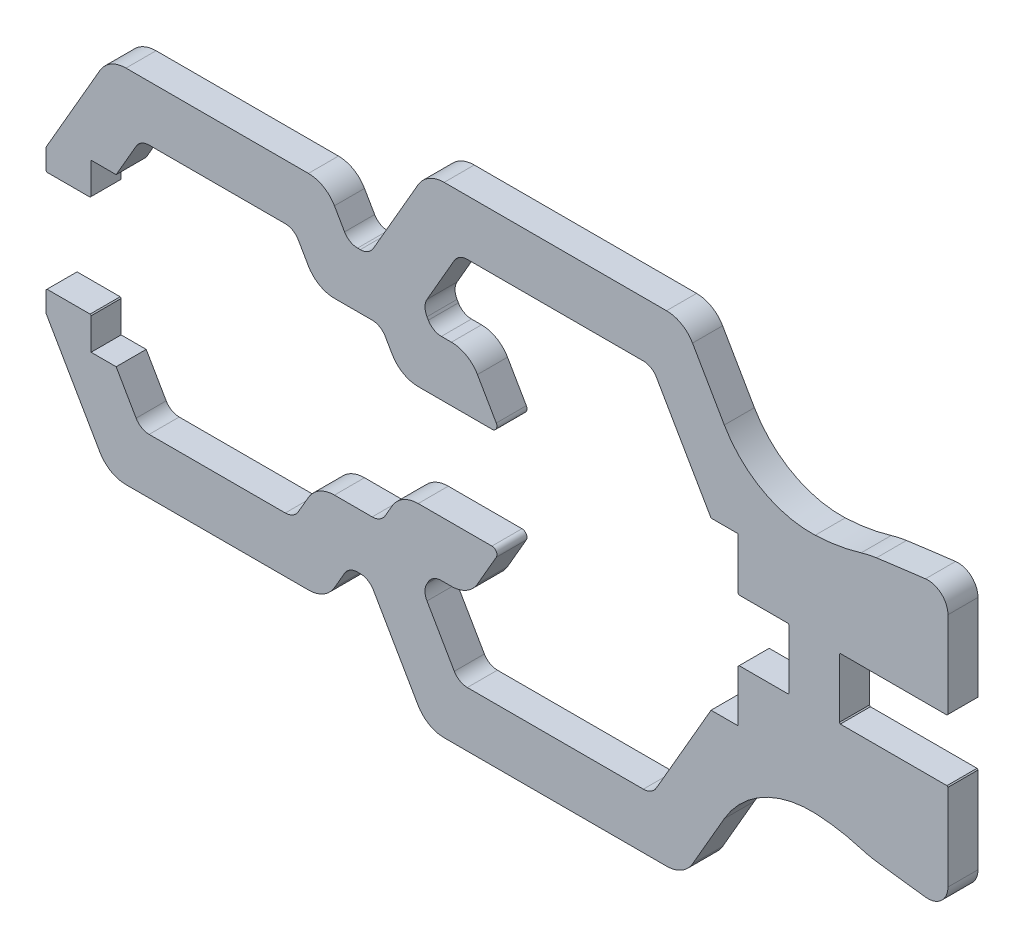
from build123d import *

# Parameters (mm, degrees)
EXTRUDE_1_DEPTH = 1.5
FILLET_4_R      = 10
FILLET_7_R      = 1.5
FILLET_8_R      = 3
CHAMFER_1_SIZE  = 0.1
FILLET_9_R      = 2
FILLET_10_R     = 0.5


with BuildPart() as part:
    # 草图1 → 凸台-拉伸1 (new, symmetric)
    with BuildSketch(Plane.XY):
        with BuildLine():
            Line((-130, 3.05), (-130, 14.015709241))
            ThreePointArc((-130, 14.015709241), (-134.003306479, 13.533897343), (-138, 13))
            ThreePointArc((-138, 13), (-144, 12), (-150, 13))
            Line((-150, 13), (-156.350852961, 24))
            Line((-156.350852961, 24), (-182, 24))
            Line((-182, 24), (-187.773502692, 14))
            Line((-187.773502692, 14), (-189.773502692, 14))
            Line((-189.773502692, 14), (-192.082903769, 18))
            Line((-192.082903769, 18), (-213.75055535, 18))
            Line((-213.75055535, 18), (-220, 7.175644347))
            Line((-220, 7.175644347), (-220, 5.05))
            Line((-220, 5.05), (-215.5, 5.05))
            Line((-215.5, 5.05), (-215.5, 8.3))
            Line((-215.5, 8.3), (-213, 8.3))
            Line((-213, 8.3), (-210.575128869, 12.5))
            Line((-210.575128869, 12.5), (-195.258330249, 12.5))
            Line((-195.258330249, 12.5), (-192.948929172, 8.5))
            Line((-192.948929172, 8.5), (-186.581793069, 8.5))
            Line((-186.581793069, 8.5), (-184.58993464, 5.05))
            Line((-184.58993464, 5.05), (-174.637306696, 5.05))
            Line((-174.637306696, 5.05), (-177.812733176, 10.55))
            Line((-177.812733176, 10.55), (-181.41450816, 10.55))
            Line((-181.41450816, 10.55), (-182.41450816, 12.282050808))
            Line((-182.41450816, 12.282050808), (-178.824573519, 18.5))
            Line((-178.824573519, 18.5), (-159.526279442, 18.5))
            Line((-159.526279442, 18.5), (-153.637306696, 8.3))
            Line((-153.637306696, 8.3), (-150.937306696, 8.3))
            Line((-150.937306696, 8.3), (-150.937306696, 3.05))
            Line((-150.937306696, 3.05), (-145.837306696, 3.05))
            Line((-145.837306696, 3.05), (-145.837306696, -3.05))
            Line((-145.837306696, -3.05), (-150.937306696, -3.05))
            Line((-150.937306696, -3.05), (-150.937306696, -8.3))
            Line((-150.937306696, -8.3), (-153.637306696, -8.3))
            Line((-153.637306696, -8.3), (-159.526279442, -18.5))
            Line((-159.526279442, -18.5), (-178.824573519, -18.5))
            Line((-178.824573519, -18.5), (-182.41450816, -12.282050808))
            Line((-182.41450816, -12.282050808), (-181.41450816, -10.55))
            Line((-181.41450816, -10.55), (-177.812733176, -10.55))
            Line((-177.812733176, -10.55), (-174.637306696, -5.05))
            Line((-174.637306696, -5.05), (-184.58993464, -5.05))
            Line((-184.58993464, -5.05), (-186.581793069, -8.5))
            Line((-186.581793069, -8.5), (-192.948929172, -8.5))
            Line((-192.948929172, -8.5), (-195.258330249, -12.5))
            Line((-195.258330249, -12.5), (-210.575128869, -12.5))
            Line((-210.575128869, -12.5), (-213, -8.3))
            Line((-213, -8.3), (-215.5, -8.3))
            Line((-215.5, -8.3), (-215.5, -5.05))
            Line((-215.5, -5.05), (-220, -5.05))
            Line((-220, -5.05), (-220, -7.175644347))
            Line((-220, -7.175644347), (-213.75055535, -18))
            Line((-213.75055535, -18), (-192.082903769, -18))
            Line((-192.082903769, -18), (-189.773502692, -14))
            Line((-189.773502692, -14), (-187.773502692, -14))
            Line((-187.773502692, -14), (-182, -24))
            Line((-182, -24), (-156.350852961, -24))
            Line((-156.350852961, -24), (-150, -13))
            ThreePointArc((-150, -13), (-144, -12), (-138, -13))
            ThreePointArc((-138, -13), (-134.003306479, -13.533897343), (-130, -14.015709241))
            Line((-130, -14.015709241), (-130, -3.05))
            Line((-130, -3.05), (-140.837306696, -3.05))
            Line((-140.837306696, -3.05), (-140.837306696, 3.05))
            Line((-140.837306696, 3.05), (-130, 3.05))
        make_face()
    extrude(amount=EXTRUDE_1_DEPTH, both=True)

    # 圆角4
    fillet_4_edges = [part.edges().sort_by_distance(p)[0] for p in [
        (-138, -13, 0),
        (-138, 13, 0),
        (-150, 13, 0),
        (-150, -13, 0),
    ]]
    fillet(fillet_4_edges, radius=FILLET_4_R)

    # 圆角7
    fillet_7_edges = [part.edges().sort_by_distance(p)[0] for p in [
        (-210.575128869, 12.5, 0),
        (-210.575128869, -12.5, 0),
        (-195.258330249, -12.5, 0),
        (-186.581793069, 8.5, 0),
        (-195.258330249, 12.5, 0),
        (-178.824573519, 18.5, 0),
        (-159.526279442, 18.5, 0),
        (-159.526279442, -18.5, 0),
        (-178.824573519, -18.5, 0),
        (-186.581793069, -8.5, 0),
        (-182.41450816, 12.282050808, 0),
        (-181.41450816, 10.55, 0),
        (-181.41450816, -10.55, 0),
        (-182.41450816, -12.282050808, 0),
        (-189.773502692, -14, 0),
        (-187.773502692, -14, 0),
        (-187.773502692, 14, 0),
        (-189.773502692, 14, 0),
    ]]
    fillet(fillet_7_edges, radius=FILLET_7_R)

    # 圆角8
    fillet_8_edges = [part.edges().sort_by_distance(p)[0] for p in [
        (-213.75055535, 18, 0),
        (-213.75055535, -18, 0),
        (-192.082903769, -18, 0),
        (-192.082903769, 18, 0),
        (-177.812733176, 10.55, 0),
        (-177.812733176, -10.55, 0),
        (-184.58993464, 5.05, 0),
        (-192.948929172, 8.5, 0),
        (-192.948929172, -8.5, 0),
        (-184.58993464, -5.05, 0),
        (-182, 24, 0),
        (-156.350852961, 24, 0),
        (-156.350852961, -24, 0),
        (-182, -24, 0),
    ]]
    fillet(fillet_8_edges, radius=FILLET_8_R)

    # 倒角1
    chamfer_1_edges = [part.edges().sort_by_distance(p)[0] for p in [
        (-145.837306696, 3.05, 0),
        (-145.837306696, -3.05, 0),
        (-140.837306696, -3.05, 0),
        (-140.837306696, 3.05, 0),
        (-150.937306696, -3.05, 0),
        (-150.937306696, 3.05, 0),
        (-130, -3.05, 0),
        (-130, 3.05, 0),
        (-220, -5.05, 0),
        (-215.5, -5.05, 0),
        (-215.5, 5.05, 0),
        (-220, 5.05, 0),
    ]]
    chamfer(chamfer_1_edges, length=CHAMFER_1_SIZE)

    # 圆角9
    fillet_9_edges = [part.edges().sort_by_distance(p)[0] for p in [
        (-130, -14.015709241, 0),
        (-130, 14.015709241, 0),
    ]]
    fillet(fillet_9_edges, radius=FILLET_9_R)

    # 圆角10
    fillet_10_edges = [part.edges().sort_by_distance(p)[0] for p in [
        (-174.637306696, -5.05, 0),
        (-174.637306696, 5.05, 0),
    ]]
    fillet(fillet_10_edges, radius=FILLET_10_R)


solid = part.part
